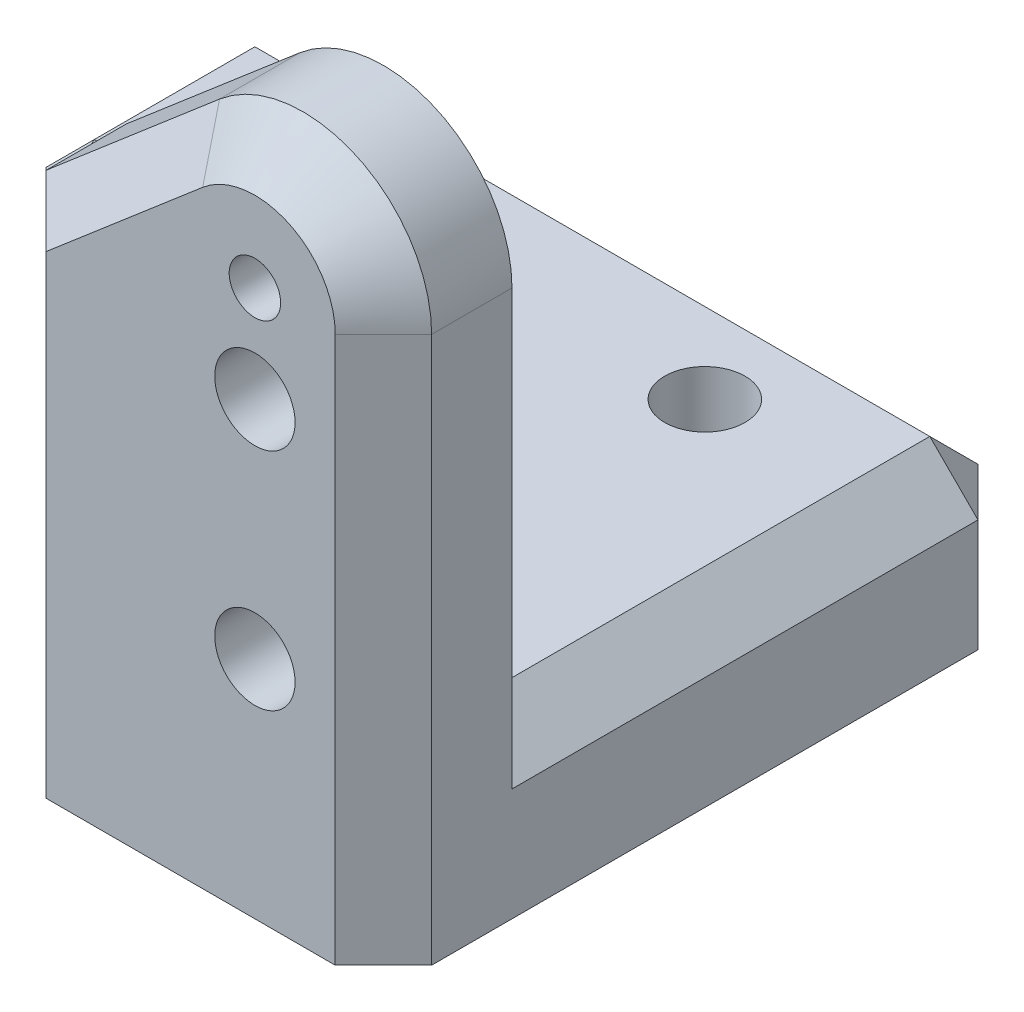
from build123d import *

# Parameters (mm, degrees)
RESSALTO_EXTRUS_O1_DEPTH                = 20
ESBO_O2_W                               = 16
ESBO_O2_H                               = 16
CORTE_EXTRUS_O1_DEPTH                   = 20
CORTE_EXTRUS_O2_DEPTH                   = 34.120990323
CHANFRO2_SIZE                           = 1.5
FURO_ROSCADO_DE_M21_D                   = 1.6
ESBO_O8_W                               = 8
ESBO_O8_H                               = 5
RESSALTO_EXTRUS_O2_DEPTH                = 12
CHANFRO3_SIZE                           = 1.5
FURO_ROSCADO_DE_M31_D                   = 2.5
FURO_ROSCADO_DE_M31_DEPTH               = 8.5
FURO_ROSCADO_DE_M31_TIP                 = 0.751075774
BROCA_DE_ROSQUEAR_PARA_TARRAXA_DE_M31_D = 2.5


with BuildPart() as part:
    # Esboço1 → Ressalto-extrusão1 (new body)
    with BuildSketch(Plane.XY):
        with BuildLine():
            Line((0, 0), (0, 12))
            Line((0, 12), (9.400080843, 20.039805977))
            ThreePointArc((9.400080843, 20.039805977), (13.673368365, 20.633158174), (16, 17))
            Line((16, 17), (16, 4))
            Line((16, 4), (16, 0))
            Line((16, 0), (0, 0))
        make_face()
    extrude(amount=RESSALTO_EXTRUS_O1_DEPTH)

    # Esboço2 → Corte-extrusão1 (cut)
    with BuildSketch(Plane(origin=(16, 0, 0), x_dir=(0, 0, -1), z_dir=(1, 0, 0))):
        with Locations((-8, 13)):
            Rectangle(ESBO_O2_W, ESBO_O2_H)
    extrude(amount=-CORTE_EXTRUS_O1_DEPTH, mode=Mode.SUBTRACT)

    # Esboço3 → Corte-extrusão2 (cut, through all)
    with BuildSketch(Plane.XY.offset(20)):
        Polygon((0, 0), (4, 0), (4, 15.42116461), (0, 12), align=None)
    extrude(amount=-CORTE_EXTRUS_O2_DEPTH, mode=Mode.SUBTRACT)

    # Chanfro2
    chanfro2_edges = [part.edges().sort_by_distance(p)[0] for p in [
        (13.673368365, 20.633158174, 20),
        (6.700040421, 17.730485293, 20),
        (4, 7.710582305, 20),
        (16, 8.5, 20),
    ]]
    chamfer(chanfro2_edges, length=CHANFRO2_SIZE)

    # Furo roscado de M21 (through all)
    with Locations(Plane(origin=(12, 17, 20), x_dir=(1, 0, 0), z_dir=(0, 0, 1))):
        with Locations((0, 0)):
            Hole(FURO_ROSCADO_DE_M21_D / 2)

    # Esboço8 → Ressalto-extrusão2 (add)
    with BuildSketch(Plane.ZY.offset(-4)):
        with Locations((4, 2.5)):
            Rectangle(ESBO_O8_W, ESBO_O8_H)
    extrude(amount=RESSALTO_EXTRUS_O2_DEPTH)

    # Chanfro3
    chanfro3_edges = [part.edges().sort_by_distance(p)[0] for p in [
        (-2, 5, 8),
        (-8, 2.5, 0),
        (-8, 2.5, 8),
        (-8, 5, 4),
        (4, 5, 0),
        (16, 5, 8),
        (16, 2.5, 0),
        (4, 5, 12),
        (4, 2.5, 8),
    ]]
    chamfer(chanfro3_edges, length=CHANFRO3_SIZE)

    # Furo roscado de M31
    with Locations(Plane(origin=(-2, 0, 4), x_dir=(0, 0, -1), z_dir=(0, -1, 0))):
        with Locations((0, 0), (0, 12), (-10, 12)):
            Hole(FURO_ROSCADO_DE_M31_D / 2, depth=FURO_ROSCADO_DE_M31_DEPTH)
            with Locations((0, 0, -(FURO_ROSCADO_DE_M31_DEPTH + FURO_ROSCADO_DE_M31_TIP / 2))):  # 118° drill point
                Cone(0, FURO_ROSCADO_DE_M31_D / 2, FURO_ROSCADO_DE_M31_TIP, mode=Mode.SUBTRACT)

    # Broca de rosquear para tarraxa de M31 (through all)
    with Locations(Plane(origin=(12, 7, 20), x_dir=(1, 0, 0), z_dir=(0, 0, 1))):
        with Locations((0, 0), (0, 7)):
            Hole(BROCA_DE_ROSQUEAR_PARA_TARRAXA_DE_M31_D / 2)


solid = part.part
